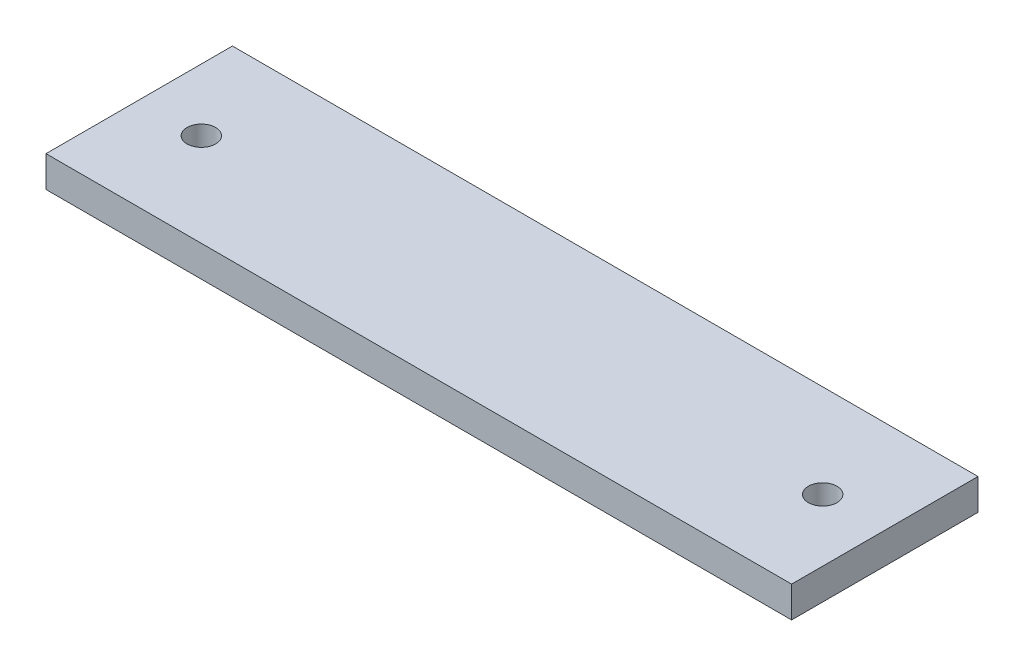
from build123d import *

# Parameters (mm, degrees)
SKETCH1_W           = 177.8
SKETCH1_H           = 19.05
SKETCH1_R           = 1.4605
BOSS_EXTRUDE1_DEPTH = 3.175
SKETCH2_W           = 101.6
SKETCH2_H           = 19.05
CUT_EXTRUDE1_DEPTH  = 179.84580824


with BuildPart() as part:
    # Sketch1 → Boss-Extrude1 (new body)
    with BuildSketch(Plane(origin=(0, 0, 0), x_dir=(1, 0, 0), z_dir=(0, 1, 0))):
        with Locations((88.9, 9.525)):
            Rectangle(SKETCH1_W, SKETCH1_H)
        with Locations(Location((6.35, 9.525, 0), (0, 0, 270))):
            Circle(SKETCH1_R, mode=Mode.SUBTRACT)
        with Locations(Location((107.95, 9.525, 0), (0, 0, 270))):
            Circle(SKETCH1_R, mode=Mode.SUBTRACT)
        with Locations(Location((171.45, 9.525, 0), (0, 0, 270))):
            Circle(SKETCH1_R, mode=Mode.SUBTRACT)
    extrude(amount=BOSS_EXTRUDE1_DEPTH)

    # Sketch2 → Cut-Extrude1 (cut, through all)
    with BuildSketch(Plane(origin=(0, 3.175, 0), x_dir=(1, 0, 0), z_dir=(0, 1, 0))):
        with Locations((50.8, 9.525)):
            Rectangle(SKETCH2_W, SKETCH2_H)
    extrude(amount=-CUT_EXTRUDE1_DEPTH, mode=Mode.SUBTRACT)


solid = part.part
